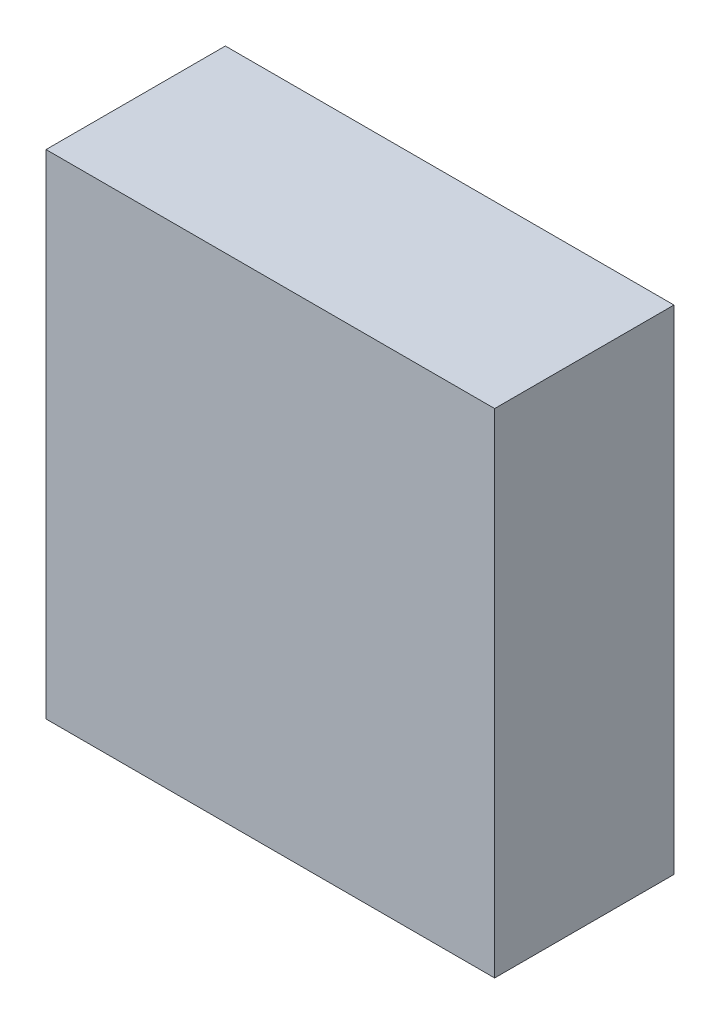
from build123d import *

# Parameters (mm, degrees)
SKETCH1_W               = 2.5016
SKETCH1_H               = 2.75
COMPONENT_OUTLINE_DEPTH = 1


with BuildPart() as part:
    # Sketch1 → Component_Outline (new body)
    with BuildSketch(Plane.XY):
        with Locations((-0.0508, 0.175)):
            Rectangle(SKETCH1_W, SKETCH1_H)
    extrude(amount=COMPONENT_OUTLINE_DEPTH)


solid = part.part
